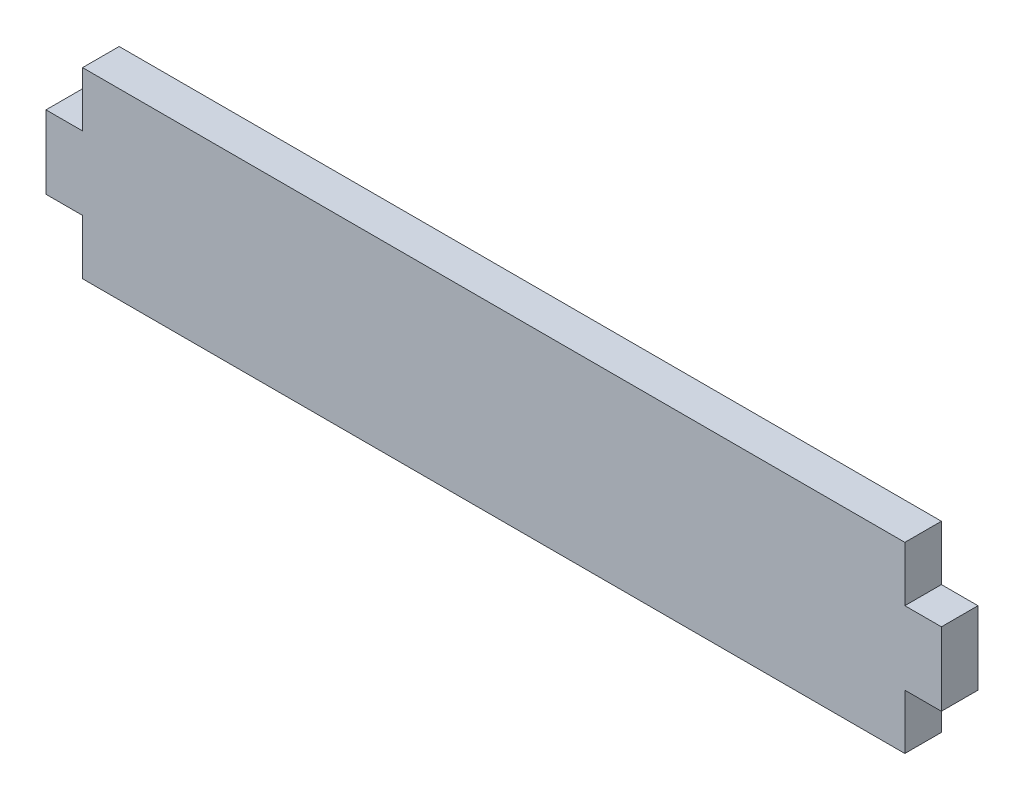
from build123d import *

# Parameters (mm, degrees)
EXTRUDE_1_DEPTH = 5


with BuildPart() as part:
    # 스케치1 → 보스-돌출1 (new body)
    with BuildSketch(Plane.XY):
        Polygon((-61.2, -5), (-56.2, -5), (-56.2, -12.5), (56.2, -12.5), (56.2, -5), (61.2, -5), (61.2, 5), (56.2, 5), (56.2, 12.5), (-56.2, 12.5), (-56.2, 5), (-61.2, 5), align=None)
    extrude(amount=EXTRUDE_1_DEPTH)


solid = part.part
